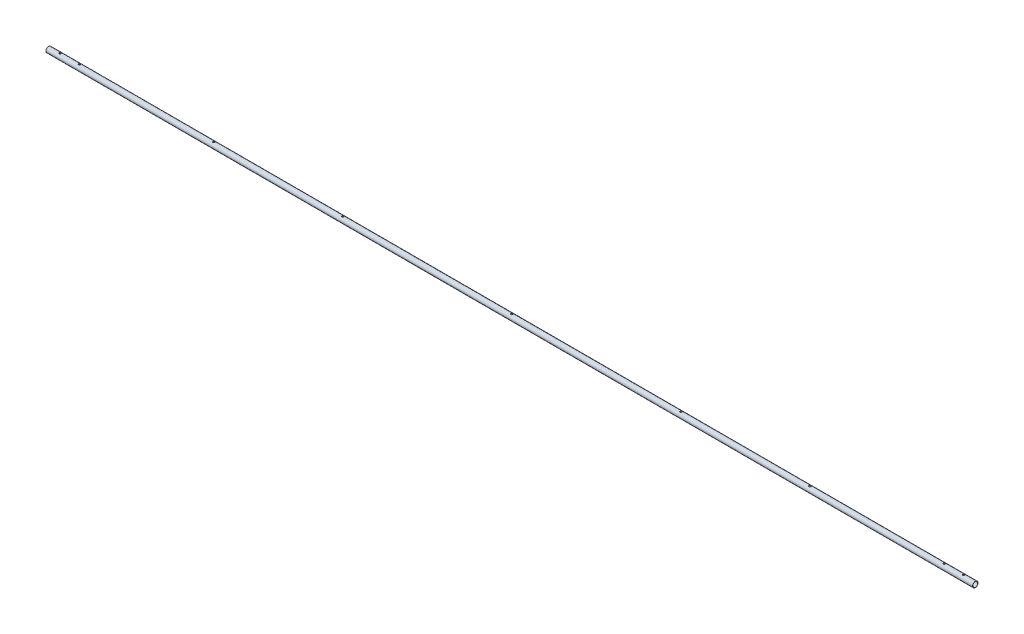
from build123d import *

# Parameters (mm, degrees)
SKETCH1_R               = 8.9662
SKETCH1_R_2             = 7.8994
BOSS_EXTRUDE1_DEPTH     = 3048
CUT_EXTRUDE2_DEPTH      = 3049.026375458
CUT_EXTRUDE2_DEPTH_BACK = 3049.026375458
SKETCH3_R               = 3.175
CUT_EXTRUDE5_DEPTH      = 3049.026375558
CUT_EXTRUDE5_DEPTH_BACK = 3049.026375558
SKETCH2_R               = 3.175


with BuildPart() as part:
    # Sketch1 → Boss-Extrude1 (new body)
    with BuildSketch(Plane(origin=(0, 0, 0), x_dir=(0, 0, -1), z_dir=(1, 0, 0))):
        Circle(SKETCH1_R)
        Circle(SKETCH1_R_2, mode=Mode.SUBTRACT)
    extrude(amount=BOSS_EXTRUDE1_DEPTH)

    # Sketch3 → Cut-Extrude2 (cut, two sides: drawn at the far end of the back side and taken through both)
    with BuildSketch(Plane(origin=(0, 0, 0), x_dir=(1, 0, 0), z_dir=(0, 1, 0)).offset(-CUT_EXTRUDE2_DEPTH_BACK)):
        with Locations(Location((1524, 0, 0), (0, 0, 270))):
            Circle(SKETCH3_R)
        with Locations(Location((2080.26, 0, 0), (0, 0, 270))):
            Circle(SKETCH3_R)
        with Locations(Location((967.74, 0, 0), (0, 0, 270))):
            Circle(SKETCH3_R)
        with Locations(Location((543.56, 0, 0), (0, 0, 270))):
            Circle(SKETCH3_R)
        with Locations(Location((2504.44, 0, 0), (0, 0, 270))):
            Circle(SKETCH3_R)
    extrude(amount=CUT_EXTRUDE2_DEPTH + CUT_EXTRUDE2_DEPTH_BACK, mode=Mode.SUBTRACT)

    # Sketch2 → Cut-Extrude5 (cut, two sides: drawn at the far end of the back side and taken through both)
    with BuildSketch(Plane(origin=(0, 0, 0), x_dir=(1, 0, 0), z_dir=(0, 1, 0)).offset(-CUT_EXTRUDE5_DEPTH_BACK)):
        with Locations(Location((38.1, 0, 0), (0, 0, 270))):
            Circle(SKETCH2_R)
        with Locations(Location((3009.9, 0, 0), (0, 0, 270))):
            Circle(SKETCH2_R)
        with Locations(Location((101.6, 0, 0), (0, 0, 270))):
            Circle(SKETCH2_R)
        with Locations(Location((2946.4, 0, 0), (0, 0, 270))):
            Circle(SKETCH2_R)
    extrude(amount=CUT_EXTRUDE5_DEPTH + CUT_EXTRUDE5_DEPTH_BACK, mode=Mode.SUBTRACT)


solid = part.part
